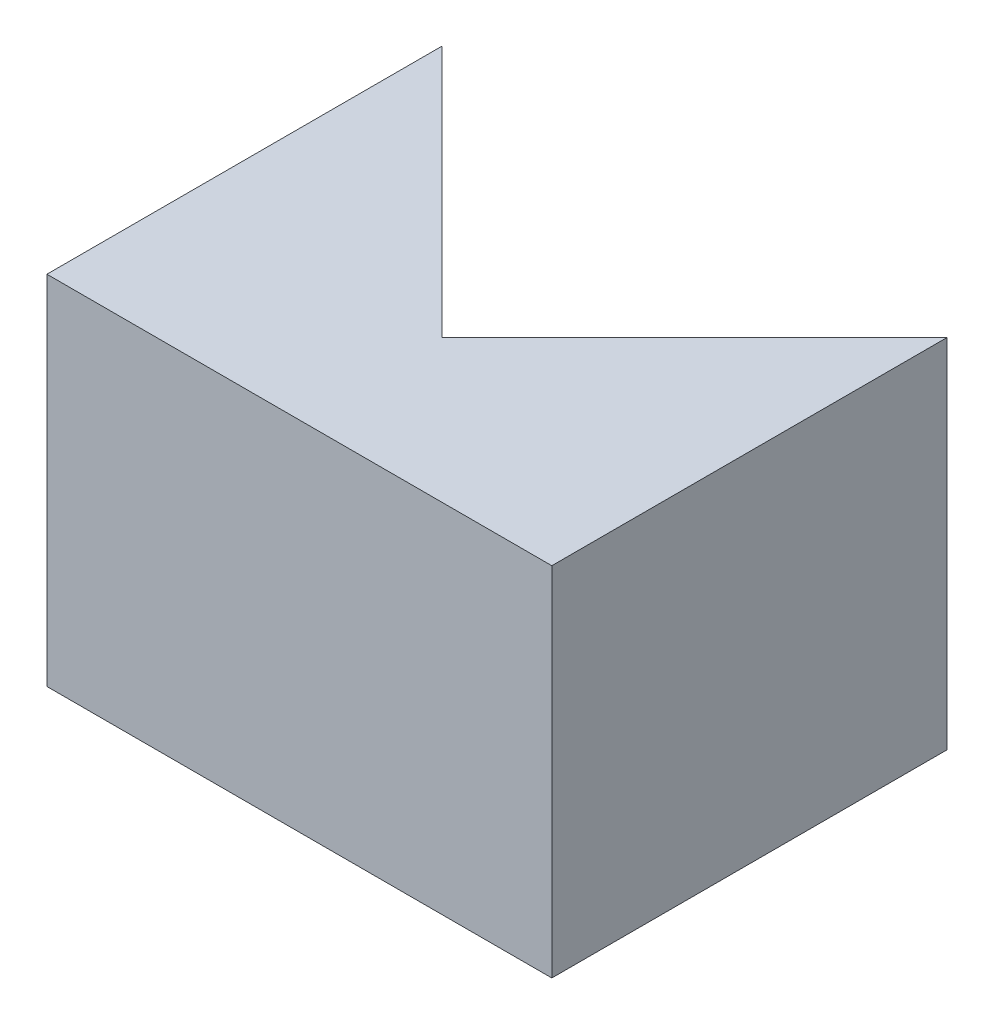
from build123d import *

# Parameters (mm, degrees)
SKETCH1_W           = 28.28
SKETCH1_H           = 20
BOSS_EXTRUDE1_DEPTH = 40
SKETCH2_W           = 28.28
SKETCH2_H           = 17.86
CUT_EXTRUDE1_DEPTH  = 29
SKETCH3_R           = 2.675
CUT_EXTRUDE2_DEPTH  = 19
CUT_EXTRUDE3_START  = -7
SKETCH4_R           = 5
CUT_EXTRUDE3_DEPTH  = 19


with BuildPart() as part:
    # Sketch1 → Boss-Extrude1 (new body)
    with BuildSketch(Plane.XY):
        with Locations((3.569509613, -2.786541121)):
            Rectangle(SKETCH1_W, SKETCH1_H)
    extrude(amount=BOSS_EXTRUDE1_DEPTH)

    # Sketch2 → Cut-Extrude1 (cut)
    with BuildSketch(Plane.XZ.offset(12.786541121)):
        Polygon((-10.570490387, 0), (3.569509613, 14.14), (17.709509613, 0), align=None)
        with Locations((3.569509613, 31.07)):
            Rectangle(SKETCH2_W, SKETCH2_H)
    extrude(amount=-CUT_EXTRUDE1_DEPTH, mode=Mode.SUBTRACT)

    # Sketch3 → Cut-Extrude2 (cut)
    with BuildSketch(Plane(origin=(-5.285245194, 0, 5.285245194), x_dir=(-0.707106781186544, 0, -0.7071067811865511), z_dir=(0.7071067811865511, 0, -0.707106781186544))):
        with Locations((-2.524024453, -2.786541121)):
            Circle(SKETCH3_R)
    extrude(amount=-CUT_EXTRUDE2_DEPTH, mode=Mode.SUBTRACT)

    # Sketch4 → Cut-Extrude3 (cut)
    with BuildSketch(Plane(origin=(-5.285245194, 0, 5.285245194), x_dir=(-0.707106781186544, 0, -0.7071067811865511), z_dir=(0.7071067811865511, 0, -0.707106781186544)).offset(CUT_EXTRUDE3_START)):
        with Locations((-2.524024453, -2.786541121)):
            Circle(SKETCH4_R)
    extrude(amount=-CUT_EXTRUDE3_DEPTH, mode=Mode.SUBTRACT)


solid = part.part
